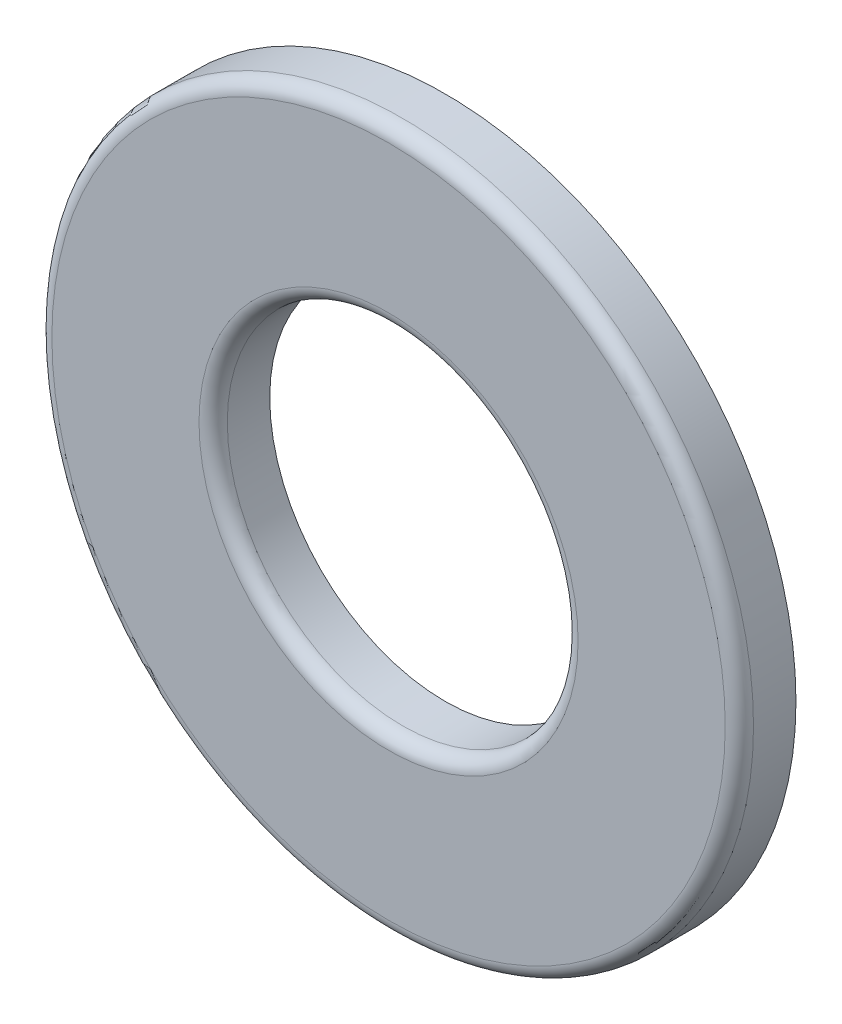
from build123d import *

# Parameters (mm, degrees)
BOSS_EXTRUDE1_DEPTH      = 0.83185
BOSS_EXTRUDE1_DEPTH_BACK = 0.83185
SKETCH3_R                = 10.3124
SKETCH3_R_2              = 5.1562
FILLET1_R                = 0.415925


with BuildPart() as part:
    # Sketch3 → Boss-Extrude1 (new, two sides: drawn at the far end of the back side and taken through both)
    with BuildSketch(Plane.XY.offset(-BOSS_EXTRUDE1_DEPTH_BACK)):
        with Locations(Location((0, 0, 0), (0, 0, 180))):
            Circle(SKETCH3_R)
        with Locations(Location((0, 0, 0), (0, 0, 180))):
            Circle(SKETCH3_R_2, mode=Mode.SUBTRACT)
    extrude(amount=BOSS_EXTRUDE1_DEPTH + BOSS_EXTRUDE1_DEPTH_BACK)

    # Fillet1
    fillet1_edges = [part.edges().sort_by_distance(p)[0] for p in [
        (10.3124, 0, 0.83185),
        (5.1562, 0, 0.83185),
    ]]
    fillet(fillet1_edges, radius=FILLET1_R)


solid = part.part
